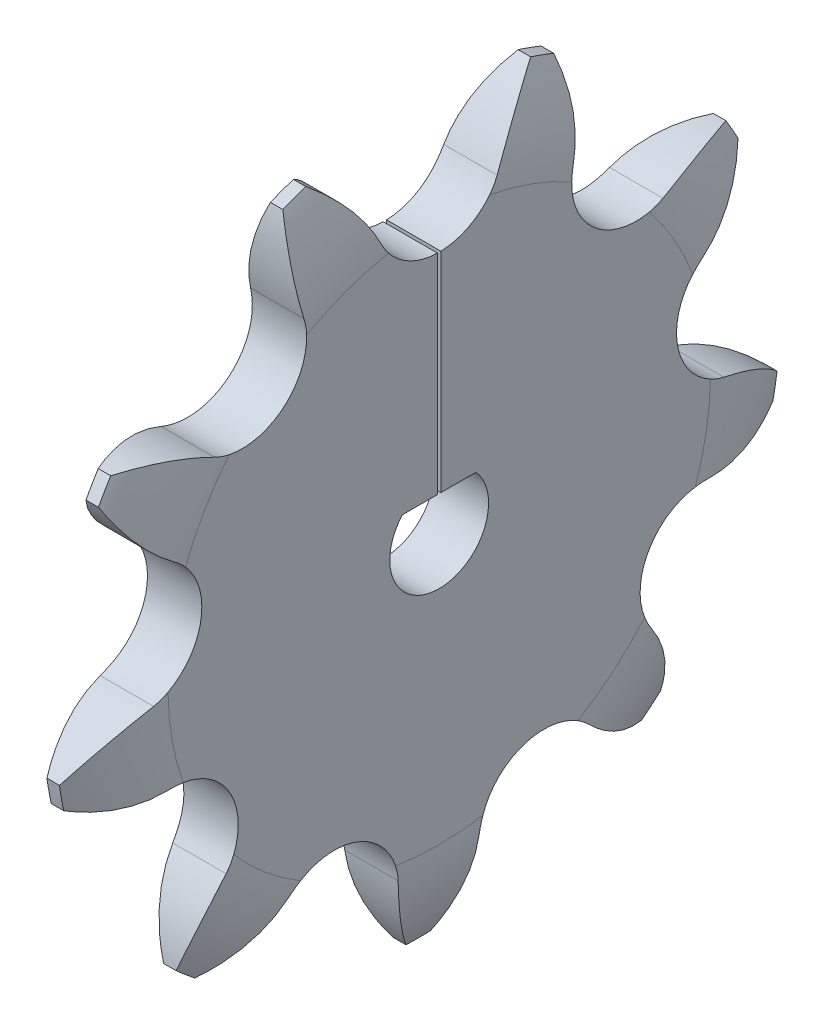
from build123d import *

# Parameters (mm, degrees)
CORTE_EXTRUS_O1_DEPTH = 32.287217837
PADR_OCIRCULAR2_COUNT = 9
CORTE_EXTRUS_O2_DEPTH = 32.134624111
ESBO_O7_W             = 0.2
ESBO_O7_H             = 30
CORTE_EXTRUS_O3_DEPTH = 10


with BuildPart() as part:
    # Esboço2 → Revolução1 (revolve)
    with BuildSketch(Plane.XY, mode=Mode.PRIVATE) as revolu_o1_sk:
        with BuildLine():
            Line((0, 0), (0, 16.464198342))
            ThreePointArc((0, 16.464198342), (0.321571182, 19.304004673), (1.27, 22))
            Line((1.27, 22), (2.03, 22))
            ThreePointArc((2.03, 22), (2.978428818, 19.304004673), (3.3, 16.464198342))
            Line((3.3, 16.464198342), (3.3, 0))
            Line((3.3, 0), (0, 0))
        make_face()
    revolve(revolu_o1_sk.sketch.rotate(Axis((0, 0, 0), (1, 0, 0)), 90), axis=Axis((0, 0, 0), (1, 0, 0)))

    # Esboço5 → Corte-extrusão1 (cut, through all)
    with BuildSketch(Plane(origin=(0, 0, 0), x_dir=(0, 0, -1), z_dir=(1, 0, 0))):
        with BuildLine():
            ThreePointArc((3.547062102, 16.950885739), (5.413227359, 19.685368366), (8.05493296, 21.680702805))
            ThreePointArc((8.05493296, 21.680702805), (0, 23.128657961), (-8.05493296, 21.680702805))
            ThreePointArc((-8.05493296, 21.680702805), (-5.413227359, 19.685368366), (-3.547062102, 16.950885739))
            ThreePointArc((-3.547062102, 16.950885739), (0, 14.691157961), (3.547062102, 16.950885739))
        make_face()
    corte_extrus_o1 = extrude(amount=CORTE_EXTRUS_O1_DEPTH, mode=Mode.SUBTRACT)

    # PadrãoCircular2: Corte-extrusão1 ×9 about axis
    padr_ocircular2_axis = Axis((0, 0, 0), (1, 0, 0))
    for i in range(1, PADR_OCIRCULAR2_COUNT):
        add(corte_extrus_o1.rotate(padr_ocircular2_axis, i * 360 / PADR_OCIRCULAR2_COUNT), mode=Mode.SUBTRACT)

    # Esboço6 → Corte-extrusão2 (cut, through all)
    with BuildSketch(Plane(origin=(3.3, 0, 0), x_dir=(0, 0, -1), z_dir=(1, 0, 0))):
        with BuildLine():
            Line((-2.236067977, 2), (2.236067977, 2))
            ThreePointArc((2.236067977, 2), (0, -3), (-2.236067977, 2))
        make_face()
    extrude(amount=-CORTE_EXTRUS_O2_DEPTH, mode=Mode.SUBTRACT)

    # Esboço7 → Corte-extrusão3 (cut)
    with BuildSketch(Plane(origin=(3.3, 0, 0), x_dir=(0, 0, -1), z_dir=(1, 0, 0))):
        with Locations((0, 17)):
            Rectangle(ESBO_O7_W, ESBO_O7_H)
    extrude(amount=-CORTE_EXTRUS_O3_DEPTH, mode=Mode.SUBTRACT)


solid = part.part
